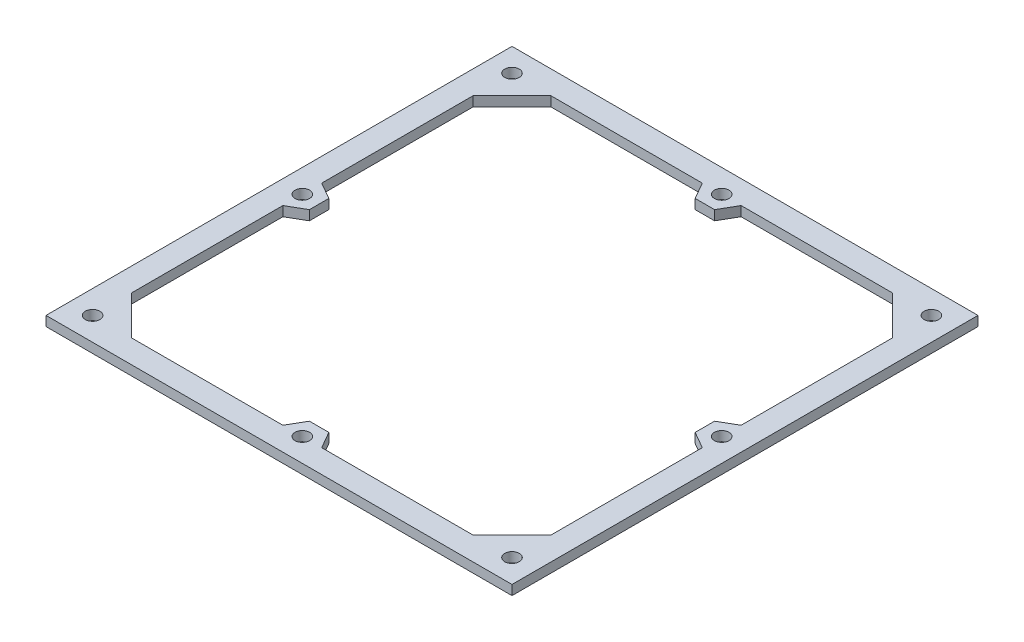
from build123d import *

# Parameters (mm, degrees)
SKETCH1_W           = 152.4
SKETCH1_H           = 152.4
SKETCH1_R           = 2.38125
BOSS_EXTRUDE4_DEPTH = 3.175


with BuildPart() as part:
    # Sketch1 → Boss-Extrude4 (new body)
    with BuildSketch(Plane(origin=(0, 0, 0), x_dir=(1, 0, 0), z_dir=(0, 1, 0))):
        with Locations((76.2, 76.2)):
            Rectangle(SKETCH1_W, SKETCH1_H)
        with Locations(Location((7.62, 7.62, 0), (0, 0, 270))):
            Circle(SKETCH1_R, mode=Mode.SUBTRACT)
        with Locations(Location((7.62, 144.78, 0), (0, 0, 270))):
            Circle(SKETCH1_R, mode=Mode.SUBTRACT)
        with Locations(Location((144.78, 144.78, 0), (0, 0, 270))):
            Circle(SKETCH1_R, mode=Mode.SUBTRACT)
        with Locations(Location((144.78, 7.62, 0), (0, 0, 270))):
            Circle(SKETCH1_R, mode=Mode.SUBTRACT)
        with Locations(Location((76.2, 7.62, 0), (0, 0, 270))):
            Circle(SKETCH1_R, mode=Mode.SUBTRACT)
        with Locations(Location((76.2, 144.78, 0), (0, 0, 270))):
            Circle(SKETCH1_R, mode=Mode.SUBTRACT)
        with Locations(Location((144.78, 76.2, 0), (0, 0, 270))):
            Circle(SKETCH1_R, mode=Mode.SUBTRACT)
        with Locations(Location((7.62, 76.2, 0), (0, 0, 270))):
            Circle(SKETCH1_R, mode=Mode.SUBTRACT)
        Polygon((69.85, 7.62), (20.32, 7.62), (7.62, 20.32), (7.62, 69.85), (13.119261314, 73.025), (13.119261314, 79.375), (7.62, 82.55), (7.62, 132.08), (20.32, 144.78), (69.85, 144.78), (73.025, 139.280738686), (79.375, 139.280738686), (82.55, 144.78), (132.08, 144.78), (144.78, 132.08), (144.78, 82.55), (139.280738686, 79.375), (139.280738686, 73.025), (144.78, 69.85), (144.78, 20.32), (132.08, 7.62), (82.55, 7.62), (79.375, 13.119261314), (73.025, 13.119261314), align=None, mode=Mode.SUBTRACT)
    extrude(amount=BOSS_EXTRUDE4_DEPTH)


solid = part.part
